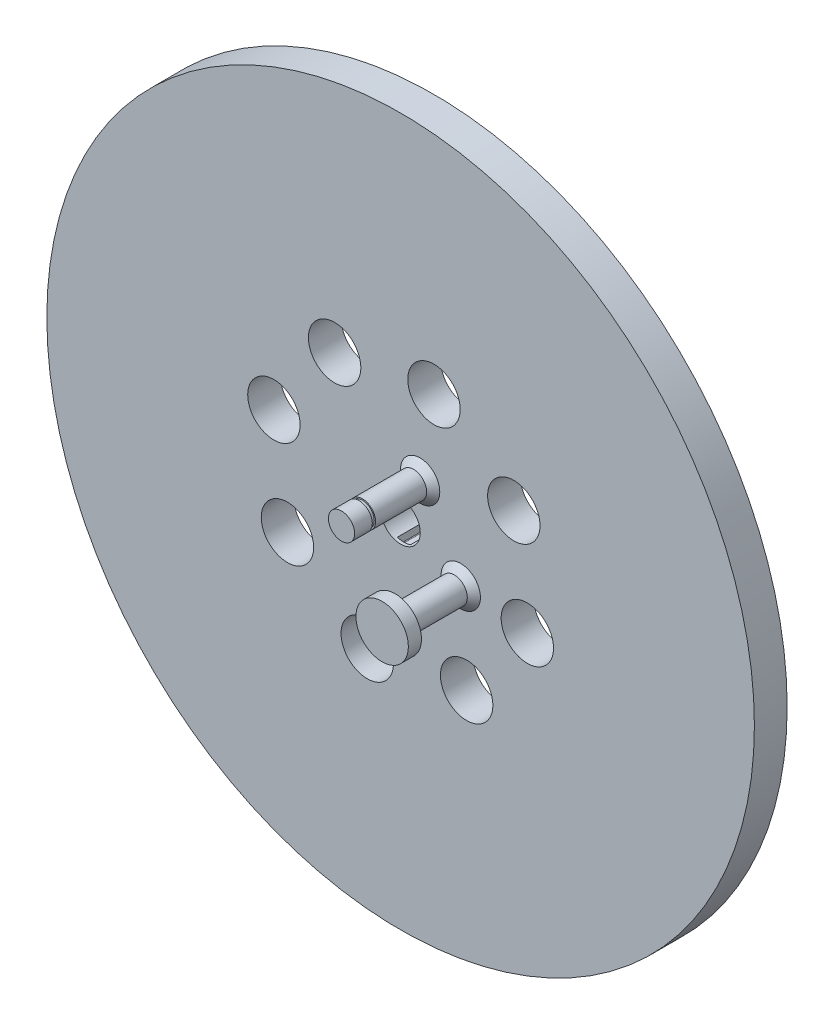
from build123d import *

# Parameters (mm, degrees)
SKETCH_1_R          = 54
SKETCH_1_R_2        = 3
EXTRUDE_1_DEPTH     = 5
SKETCH_3_R          = 4
CUT_EXTRUDE_2_DEPTH = 77.531039455
SKETCH_4_R          = 2
EXTRUDE_2_DEPTH     = 12
CUT_EXTRUDE_START   = -3.2
SKETCH_6_R          = 2
SKETCH_6_R_2        = 1.8
CUT_EXTRUDE_3_DEPTH = 0.5
SKETCH_7_R          = 4
EXTRUDE_3_DEPTH     = 2
CHAMFER_1_SIZE      = 1
CUT_EXTRUDE_START_2 = -0.5
SKETCH_9_W          = 2
SKETCH_9_H          = 2
CUT_EXTRUDE_5_DEPTH = 4
FILLET_1_R          = 0.1


with BuildPart() as part:
    # 草图1 → 凸台-拉伸1 (new body)
    with BuildSketch(Plane.XY):
        Circle(SKETCH_1_R)
        Circle(SKETCH_1_R_2, mode=Mode.SUBTRACT)
    extrude(amount=EXTRUDE_1_DEPTH)

    # 草图3 → 切除-拉伸2 (cut, through all)
    with BuildSketch(Plane(origin=(0, 0, 0), x_dir=(-1, 0, 0), z_dir=(0, 0, -1))):
        with Locations((-5.091227954, 19.341132281)):
            Circle(SKETCH_3_R)
        with Locations((10.076203981, 17.276287603)):
            Circle(SKETCH_3_R)
        with Locations((19.341132281, 5.091227954)):
            Circle(SKETCH_3_R)
        with Locations((17.276287603, -10.076203981)):
            Circle(SKETCH_3_R)
        with Locations((5.091227954, -19.341132281)):
            Circle(SKETCH_3_R)
        with Locations((-10.076203981, -17.276287603)):
            Circle(SKETCH_3_R)
        with Locations((-19.341132281, -5.091227954)):
            Circle(SKETCH_3_R)
        with Locations((-17.276287603, 10.076203981)):
            Circle(SKETCH_3_R)
    extrude(amount=-CUT_EXTRUDE_2_DEPTH, mode=Mode.SUBTRACT)

    # 草图4 → 凸台-拉伸2 (add)
    with BuildSketch(Plane.XY.offset(5)):
        with Locations((2.976659474, 6.884003078)):
            Circle(SKETCH_4_R)
        with Locations((9.178670771, -3.968879298)):
            Circle(SKETCH_4_R)
    extrude(amount=EXTRUDE_2_DEPTH)

    # 草图6 → 切除-拉伸3 (cut)
    with BuildSketch(Plane.XY.offset(17).offset(CUT_EXTRUDE_START)):
        with Locations((2.976659474, 6.884003078)):
            Circle(SKETCH_6_R)
        with Locations((2.976659474, 6.884003078)):
            Circle(SKETCH_6_R_2, mode=Mode.SUBTRACT)
    extrude(amount=CUT_EXTRUDE_3_DEPTH, mode=Mode.SUBTRACT)

    # 草图7 → 凸台-拉伸3 (add)
    with BuildSketch(Plane.XY.offset(17)):
        with Locations((9.178670771, -3.968879298)):
            Circle(SKETCH_7_R)
    extrude(amount=-EXTRUDE_3_DEPTH)

    # 倒角1
    chamfer_1_edges = [part.edges().sort_by_distance(p)[0] for p in [
        (7.178670771, -3.968879298, 5),
        (0.976659474, 6.884003078, 5),
    ]]
    chamfer(chamfer_1_edges, length=CHAMFER_1_SIZE)

    # 草图9 → 切除-拉伸5 (cut)
    with BuildSketch(Plane.XY.offset(5).offset(CUT_EXTRUDE_START_2)):
        with Locations((0, -3)):
            Rectangle(SKETCH_9_W, SKETCH_9_H)
    extrude(amount=-CUT_EXTRUDE_5_DEPTH, mode=Mode.SUBTRACT)

    # 圆角1
    fillet_1_edges = [part.edges().sort_by_distance(p)[0] for p in [
        (-1, -4, 2.5),
        (1, -4, 2.5),
    ]]
    fillet(fillet_1_edges, radius=FILLET_1_R)


solid = part.part
